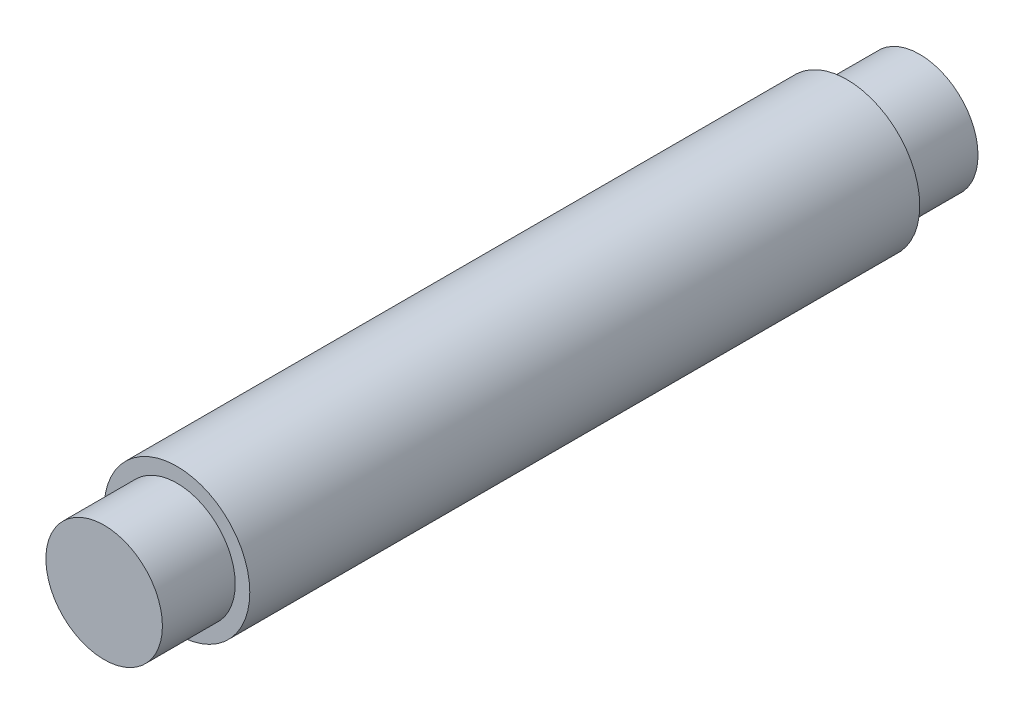
from build123d import *

# Parameters (mm, degrees)
SKETCH1_R           = 2.5
BOSS_EXTRUDE1_DEPTH = 23
SKETCH2_R           = 2
BOSS_EXTRUDE2_DEPTH = 2.5
BOSS_EXTRUDE3_START = 2.5
SKETCH3_R           = 2
BOSS_EXTRUDE3_DEPTH = 2.5


with BuildPart() as part:
    # Sketch1 → Boss-Extrude1 (new body)
    with BuildSketch(Plane.XY):
        Circle(SKETCH1_R)
    extrude(amount=BOSS_EXTRUDE1_DEPTH)

    # Sketch2 → Boss-Extrude2 (add)
    with BuildSketch(Plane.XY.offset(23)):
        Circle(SKETCH2_R)
    extrude(amount=BOSS_EXTRUDE2_DEPTH)

    # Sketch3 → Boss-Extrude3 (add)
    with BuildSketch(Plane(origin=(0, 0, 0), x_dir=(-1, 0, 0), z_dir=(0, 0, -1)).offset(BOSS_EXTRUDE3_START)):
        with Locations(Location((0, 0, 0), (0, 0, 180))):
            Circle(SKETCH3_R)
    extrude(amount=-BOSS_EXTRUDE3_DEPTH)


solid = part.part
